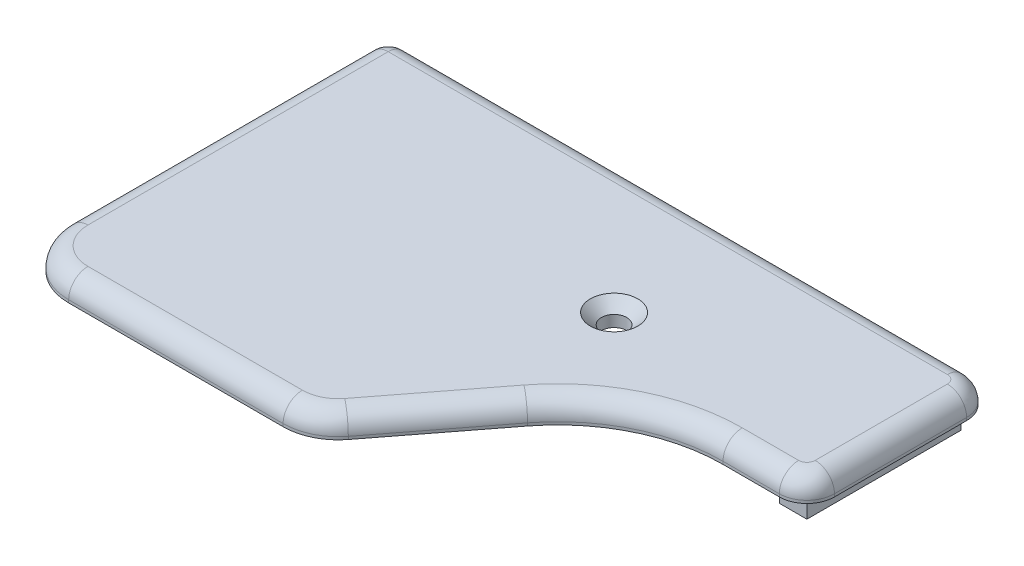
from build123d import *

# Parameters (mm, degrees)
SKETCH1_R           = 1.4605
BOSS_EXTRUDE1_DEPTH = 2.54
SKETCH12_W          = 3.175
SKETCH12_H          = 17.78
BOSS_EXTRUDE7_DEPTH = 2.54
FILLET6_R           = 19.05
FILLET7_R           = 6.35
FILLET8_R           = 3.175
FILLET9_R           = 2.2225
CHAMFER1_SIZE       = 1.27
CHAMFER1_SIZE2      = 1.226424744
FILLET10_R          = 2.2225


with BuildPart() as part:
    # Sketch1 → Boss-Extrude1 (new body)
    with BuildSketch(Plane(origin=(0, 0, 0), x_dir=(1, 0, 0), z_dir=(0, 1, 0))):
        Polygon((0, 0), (69.85, 0), (69.85, -21.59), (50.8, -21.59), (38.1, -38.1), (34.192307692, -43.18), (0, -43.18), (0, -38.1), align=None)
        with Locations(Location((41.275, -15.24, 0), (0, 0, 270))):
            Circle(SKETCH1_R, mode=Mode.SUBTRACT)
    extrude(amount=BOSS_EXTRUDE1_DEPTH)

    # Sketch12 → Boss-Extrude7 (add)
    with BuildSketch(Plane.XZ):
        with Locations((66.3575, 10.795)):
            Rectangle(SKETCH12_W, SKETCH12_H)
    extrude(amount=BOSS_EXTRUDE7_DEPTH)

    # Fillet6
    fillet6_edges = [part.edges().sort_by_distance(p)[0] for p in [
        (50.8, 1.27, 21.59),
    ]]
    fillet(fillet6_edges, radius=FILLET6_R)

    # Fillet7
    fillet7_edges = [part.edges().sort_by_distance(p)[0] for p in [
        (34.192307692, 1.27, 43.18),
        (0, 1.27, 43.18),
    ]]
    fillet(fillet7_edges, radius=FILLET7_R)

    # Fillet8
    fillet8_edges = [part.edges().sort_by_distance(p)[0] for p in [
        (69.85, 1.27, 0),
        (69.85, 1.27, 21.59),
    ]]
    fillet(fillet8_edges, radius=FILLET8_R)

    # Fillet9
    fillet9_edges = [part.edges().sort_by_distance(p)[0] for p in [
        (0, 1.27, 0),
    ]]
    fillet(fillet9_edges, radius=FILLET9_R)

    # Chamfer1
    chamfer1_edges = [part.edges().sort_by_distance(p)[0] for p in [
        (41.275, 2.54, 13.7795),
    ]]
    chamfer1_side = [part.faces().sort_by_distance(p)[0] for p in [
        (29.97778843, 2.54, 18.654075923),
    ]]
    chamfer(chamfer1_edges, length=CHAMFER1_SIZE, length2=CHAMFER1_SIZE2, reference=chamfer1_side[0])

    # Fillet10
    fillet10_edges = [part.edges().sort_by_distance(p)[0] for p in [
        (63.427624263, 2.54, 21.59),
        (51.764877453, 2.54, 23.549533953),
        (18.707779092, 2.54, 43.18),
        (40.589741024, 2.54, 34.863336669),
        (33.870681875, 2.54, 42.526822016),
        (1.859871939, 2.54, 41.320128061),
        (34.44875, 2.54, 0),
        (69.85, 2.54, 10.795),
        (68.92006403, 2.54, 20.66006403),
        (68.92006403, 2.54, 0.92993597),
        (0, 2.54, 19.52625),
        (0.650955179, 2.54, 0.650955179),
    ]]
    fillet(fillet10_edges, radius=FILLET10_R)


solid = part.part
